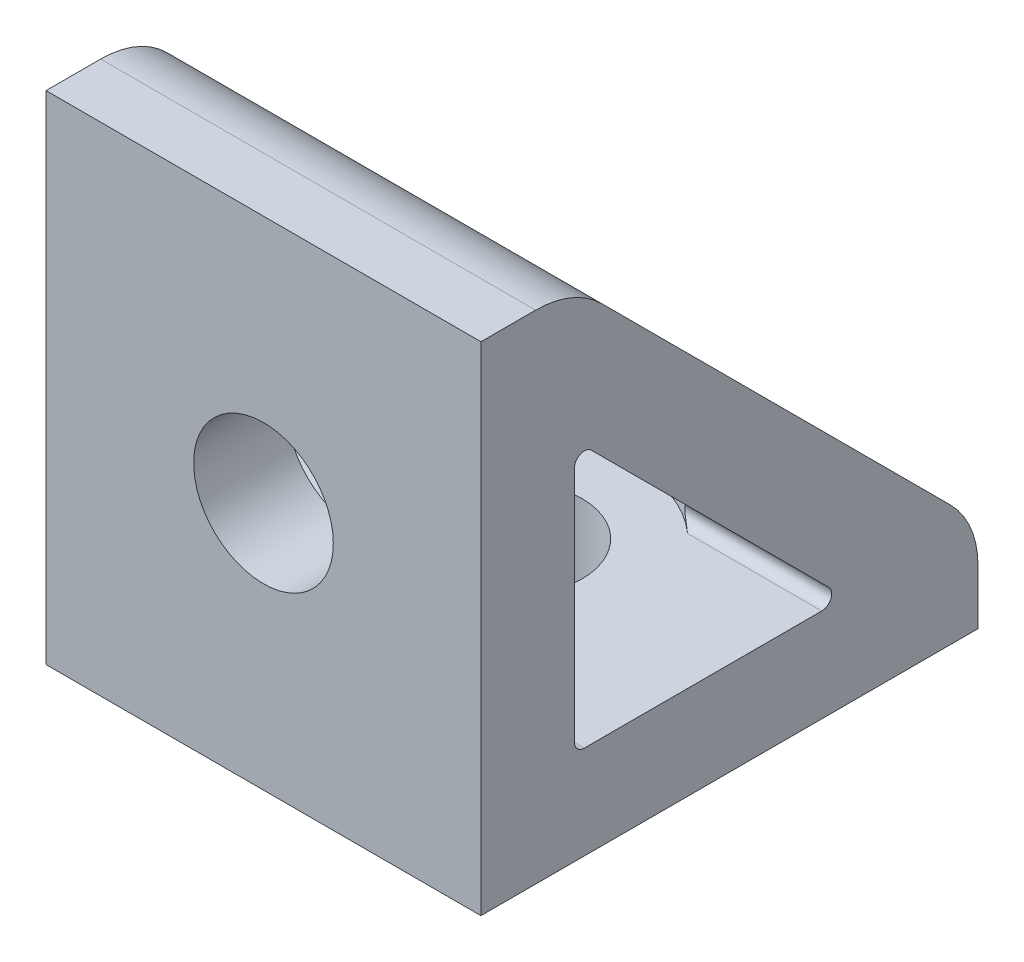
from build123d import *

# Parameters (mm, degrees)
BASE_EXTRUDE_DEPTH = 22.225
HOLE1_REACH        = 44.241
SKETCH2_R          = 3.5687
SKETCH3_R          = 6.35
HOLE1A_DEPTH       = 40.553672
HOLE2_REACH        = 44.241
SKETCH4_R          = 3.5687
SKETCH5_R          = 6.35
HOLE2A_DEPTH       = 40.553672


with BuildPart() as part:
    # Sketch1 → Base Extrude (new body)
    with BuildSketch(Plane(origin=(0, 0, 0), x_dir=(0, 0, -1), z_dir=(1, 0, 0))):
        with BuildLine():
            Line((0, 25.4), (0, 0))
            Line((0, 0), (25.4, 0))
            Line((25.4, 0), (25.4, 2.794))
            ThreePointArc((25.4, 2.794), (25.03651, 4.62139), (24.001376, 6.170576))
            Line((24.001376, 6.170576), (6.170576, 24.001376))
            ThreePointArc((6.170576, 24.001376), (4.62139, 25.03651), (2.794, 25.4))
            Line((2.794, 25.4), (0, 25.4))
        make_face()
        with BuildLine():
            Line((4.7752, 17.41718), (4.7752, 5.2832))
            ThreePointArc((4.7752, 5.2832), (4.92399, 4.92399), (5.2832, 4.7752))
            Line((5.2832, 4.7752), (17.41718, 4.7752))
            ThreePointArc((17.41718, 4.7752), (17.88651, 5.088797), (17.77639, 5.64241))
            Line((17.77639, 5.64241), (5.64241, 17.77639))
            ThreePointArc((5.64241, 17.77639), (5.088797, 17.88651), (4.7752, 17.41718))
        make_face(mode=Mode.SUBTRACT)
    extrude(amount=-BASE_EXTRUDE_DEPTH)

    # Sketch2 → Hole1 (cut, up to next)
    with BuildSketch(Plane.XZ, mode=Mode.PRIVATE) as hole1_sk1:
        with Locations(Location((-11.1125, -12.7, 0), (0, 0, 270))):
            Circle(SKETCH2_R)
    hole1_tool1 = extrude(hole1_sk1.sketch, amount=-HOLE1_REACH, mode=Mode.PRIVATE) & part.part
    add(hole1_tool1.solids().sort_by_distance((-11.1125, 0, -12.7))[0], mode=Mode.SUBTRACT)

    # Sketch3 → Hole1a (cut, through all)
    with BuildSketch(Plane(origin=(0, 4.7752, 0), x_dir=(-1, 0, 0), z_dir=(0, 1, 0))):
        with Locations((11.1125, -12.7)):
            Circle(SKETCH3_R)
    extrude(amount=HOLE1A_DEPTH, mode=Mode.SUBTRACT)

    # Sketch4 → Hole2 (cut, up to next)
    with BuildSketch(Plane.XY, mode=Mode.PRIVATE) as hole2_sk1:
        with Locations((-11.1125, 12.7)):
            Circle(SKETCH4_R)
    hole2_tool1 = extrude(hole2_sk1.sketch, amount=-HOLE2_REACH, mode=Mode.PRIVATE) & part.part
    add(hole2_tool1.solids().sort_by_distance((-11.1125, 12.7, 0))[0], mode=Mode.SUBTRACT)

    # Sketch5 → Hole2a (cut, through all)
    with BuildSketch(Plane(origin=(0, 0, -4.7752), x_dir=(-1, 0, 0), z_dir=(0, 0, -1))):
        with Locations((11.1125, 12.7)):
            Circle(SKETCH5_R)
    extrude(amount=HOLE2A_DEPTH, mode=Mode.SUBTRACT)


solid = part.part
